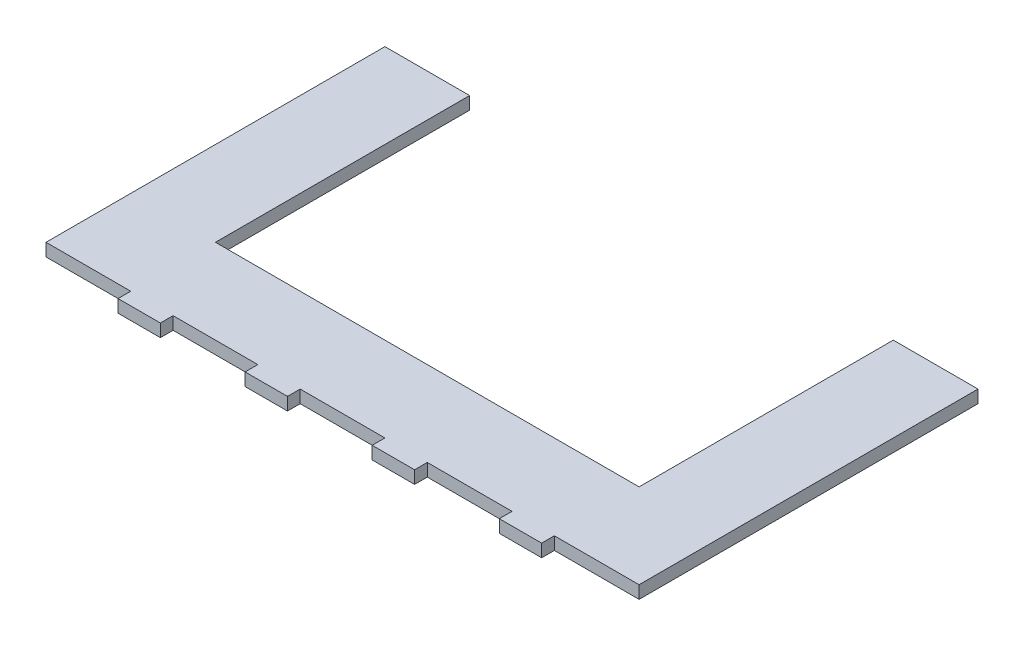
from build123d import *

# Parameters (mm, degrees)
SKETCH1_W           = 140
SKETCH1_H           = 80
BOSS_EXTRUDE1_DEPTH = 3
SKETCH2_W           = 100
SKETCH2_H           = 60
CUT_EXTRUDE1_DEPTH  = 13
SKETCH4_W           = 10
SKETCH4_H           = 3
BOSS_EXTRUDE2_DEPTH = 3


with BuildPart() as part:
    # Sketch1 → Boss-Extrude1 (new body)
    with BuildSketch(Plane(origin=(0, 0, 0), x_dir=(1, 0, 0), z_dir=(0, 1, 0))):
        Rectangle(SKETCH1_W, SKETCH1_H)
    extrude(amount=BOSS_EXTRUDE1_DEPTH)

    # Sketch2 → Cut-Extrude1 (cut)
    with BuildSketch(Plane(origin=(0, 3, 0), x_dir=(1, 0, 0), z_dir=(0, 1, 0))):
        with Locations((0, 10)):
            Rectangle(SKETCH2_W, SKETCH2_H)
    extrude(amount=-CUT_EXTRUDE1_DEPTH, mode=Mode.SUBTRACT)

    # Sketch4 → Boss-Extrude2 (add)
    with BuildSketch(Plane.XY.offset(40)):
        with Locations((-45, 1.5)):
            Rectangle(SKETCH4_W, SKETCH4_H)
        with Locations((-15, 1.5)):
            Rectangle(SKETCH4_W, SKETCH4_H)
        with Locations((15, 1.5)):
            Rectangle(SKETCH4_W, SKETCH4_H)
        with Locations((45, 1.5)):
            Rectangle(SKETCH4_W, SKETCH4_H)
    extrude(amount=BOSS_EXTRUDE2_DEPTH)


solid = part.part
